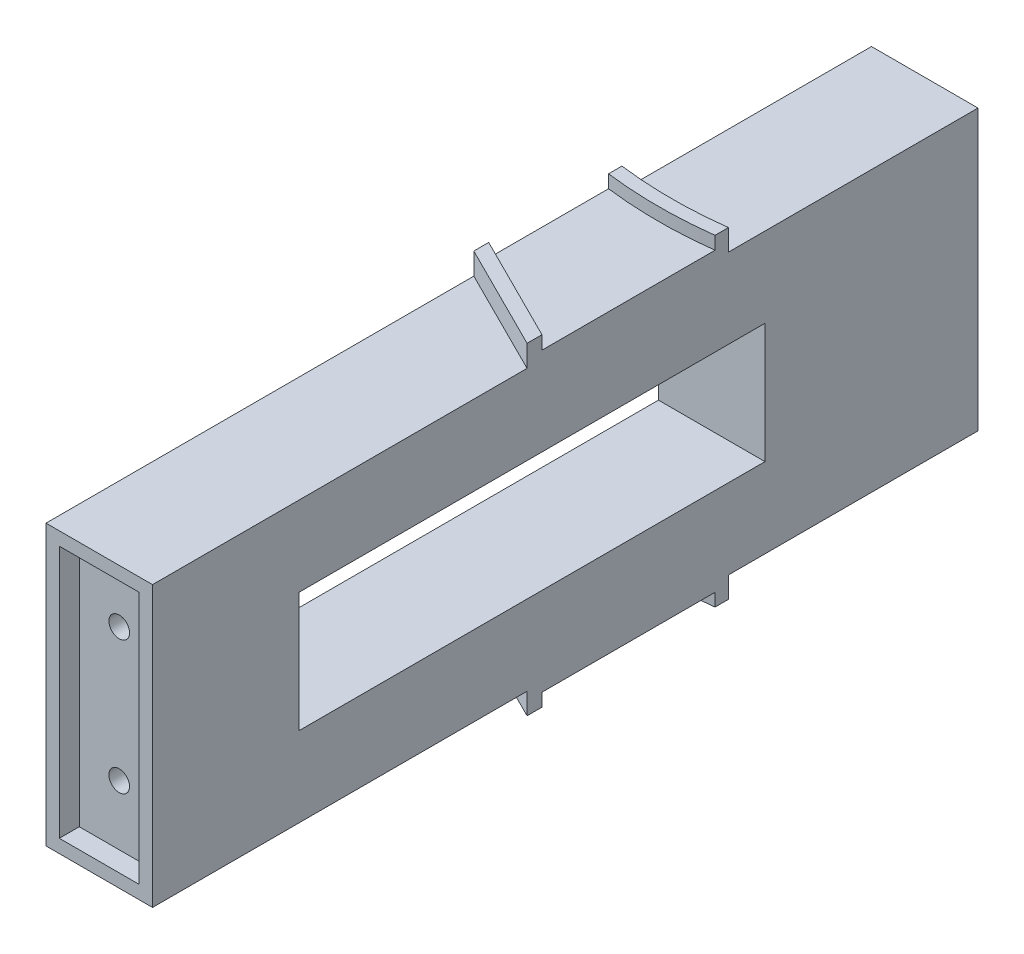
from build123d import *

# Parameters (mm, degrees)
SKETCH_1_W            = 16
SKETCH_1_H            = 42
EXTRUDE_1_DEPTH       = 124
EXTRUDE_4_DEPTH       = 24.193161441
EXTRUDE_4_DEPTH_BACK  = 24.175019218
EXTRUDE_5_DEPTH       = 24.263214739
EXTRUDE_5_DEPTH_BACK  = 24.1979861
SKETCH_7_W            = 12
SKETCH_7_H            = 38
CUT_EXTRUDE_1_DEPTH   = 3
SKETCH_8_W            = 12
SKETCH_8_H            = 38
CUT_EXTRUDE_2_DEPTH   = 25
SKETCH_9_W            = 4
SKETCH_9_H            = 20
CUT_EXTRUDE_3_DEPTH   = 2
SKETCH_10_R           = 1.55
CUT_EXTRUDE_4_DEPTH   = 20
EXTRUDE_10_DEPTH      = 22.25
EXTRUDE_10_DEPTH_BACK = 22.25
SKETCH_13_W           = 70
SKETCH_13_H           = 18
CUT_EXTRUDE_5_DEPTH   = 22.25


with BuildPart() as part:
    # Эскиз1 → Бобышка-Вытянуть1 (new body)
    with BuildSketch(Plane.XY):
        Rectangle(SKETCH_1_W, SKETCH_1_H)
    extrude(amount=EXTRUDE_1_DEPTH)

    # Эскиз5 → Бобышка-Вытянуть4 (add, two sides: drawn at the far end of the back side and taken through both)
    with BuildSketch(Plane(origin=(0, 0, 0), x_dir=(1, 0, 0), z_dir=(0, 1, 0)).offset(-EXTRUDE_4_DEPTH_BACK)):
        with BuildLine():
            Line((-8, -37.48588549), (-8, -39.501953095))
            ThreePointArc((-8, -39.501953095), (0, -40), (8, -39.501953095))
            Line((8, -39.501953095), (8, -37.48588549))
            ThreePointArc((8, -37.48588549), (0, -38), (-8, -37.48588549))
        make_face()
    extrude(amount=EXTRUDE_4_DEPTH + EXTRUDE_4_DEPTH_BACK)

    # Эскиз6 → Бобышка-Вытянуть5 (add, two sides: drawn at the far end of the back side and taken through both)
    with BuildSketch(Plane(origin=(0, 0, 0), x_dir=(1, 0, 0), z_dir=(0, 1, 0)).offset(-EXTRUDE_5_DEPTH_BACK)):
        Polygon((-8, -57.5), (8, -65.5), (8, -67.736067977), (-8, -59.736067977), align=None)
    extrude(amount=EXTRUDE_5_DEPTH + EXTRUDE_5_DEPTH_BACK)

    # Эскиз7 → Вырез-Вытянуть1 (cut)
    with BuildSketch(Plane.XY.offset(124)):
        Rectangle(SKETCH_7_W, SKETCH_7_H)
    extrude(amount=-CUT_EXTRUDE_1_DEPTH, mode=Mode.SUBTRACT)

    # Эскиз8 → Вырез-Вытянуть2 (cut)
    with BuildSketch(Plane(origin=(0, 0, 0), x_dir=(-1, 0, 0), z_dir=(0, 0, -1))):
        Rectangle(SKETCH_8_W, SKETCH_8_H)
    extrude(amount=-CUT_EXTRUDE_2_DEPTH, mode=Mode.SUBTRACT)

    # Эскиз9 → Вырез-Вытянуть3 (cut)
    with BuildSketch(Plane.ZY.offset(8)):
        with Locations((23, 0)):
            Rectangle(SKETCH_9_W, SKETCH_9_H)
    extrude(amount=-CUT_EXTRUDE_3_DEPTH, mode=Mode.SUBTRACT)

    # Эскиз10 → Вырез-Вытянуть4 (cut)
    with BuildSketch(Plane.XY.offset(121)):
        with Locations((0, 10)):
            Circle(SKETCH_10_R)
        with Locations((0, -10)):
            Circle(SKETCH_10_R)
    extrude(amount=-CUT_EXTRUDE_4_DEPTH, mode=Mode.SUBTRACT)

    # Эскиз12 → Бобышка-Вытянуть10 (add, two sides: drawn at the far end of the back side and taken through both)
    with BuildSketch(Plane(origin=(0, 0, 0), x_dir=(1, 0, 0), z_dir=(0, 1, 0)).offset(-EXTRUDE_10_DEPTH_BACK)):
        Polygon((-8, -57.5), (8, -65.5), (8, -47.5019531), (8, -39.501953095), (-8, -39.501953095), align=None)
    extrude(amount=EXTRUDE_10_DEPTH + EXTRUDE_10_DEPTH_BACK)

    # Эскиз13 → Вырез-Вытянуть5 (cut)
    with BuildSketch(Plane.ZY.offset(8)):
        with Locations((67, 0)):
            Rectangle(SKETCH_13_W, SKETCH_13_H)
    extrude(amount=-CUT_EXTRUDE_5_DEPTH, mode=Mode.SUBTRACT)


solid = part.part
